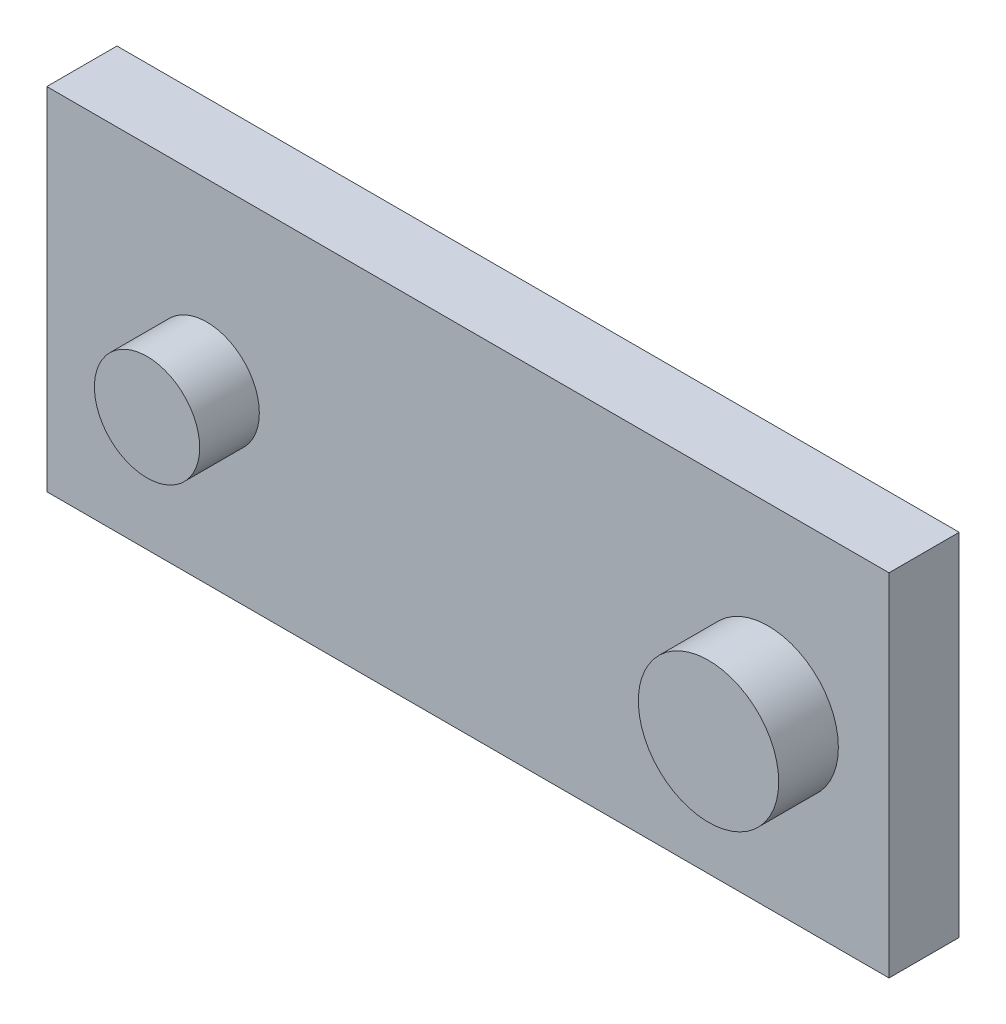
from build123d import *

# Parameters (mm, degrees)
SKETCH_1_W      = 120
SKETCH_1_H      = 50
EXTRUDE_1_DEPTH = 5
SKETCH_2_R      = 7.5
SKETCH_2_R_2    = 10
EXTRUDE_2_DEPTH = 8.5


with BuildPart() as part:
    # 草图1 → 凸台-拉伸1 (new, symmetric)
    with BuildSketch(Plane.XY):
        with Locations((34.086506066, 14.145511968)):
            Rectangle(SKETCH_1_W, SKETCH_1_H)
    extrude(amount=EXTRUDE_1_DEPTH, both=True)

    # 草图2 → 凸台-拉伸2 (add, symmetric)
    with BuildSketch(Plane.XY.offset(5)):
        with Locations((-3.130706557, 13.98825614)):
            Circle(SKETCH_2_R)
        with Locations((76.869293443, 13.98825614)):
            Circle(SKETCH_2_R_2)
    extrude(amount=EXTRUDE_2_DEPTH, both=True)


solid = part.part
